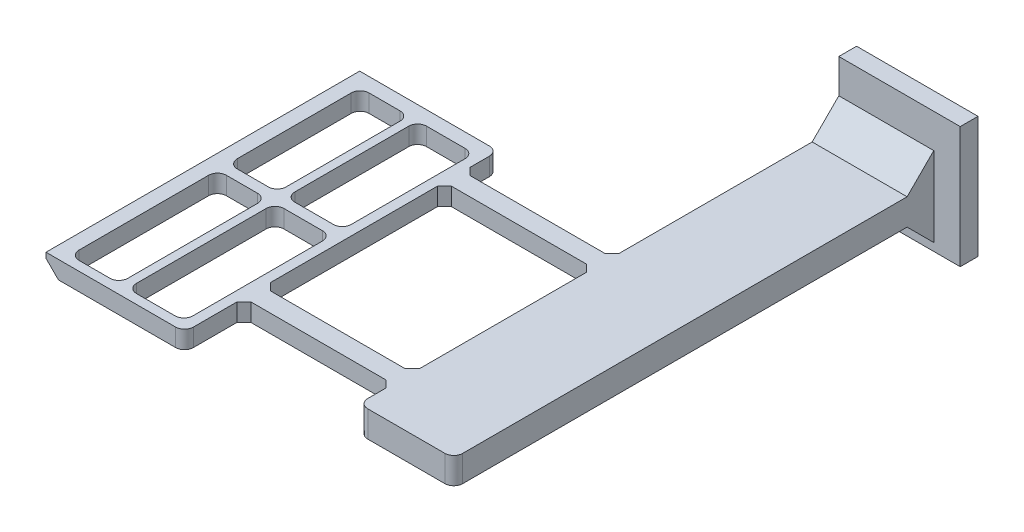
from build123d import *

# Parameters (mm, degrees)
SKETCH_1_W      = 68.292893219
SKETCH_1_H      = 68.292893218
EXTRUDE_1_DEPTH = 10
SKETCH_2_W      = 53.40749746
SKETCH_2_H      = 14.776374923
EXTRUDE_2_DEPTH = 270
SKETCH_4_W      = 27.47748939
SKETCH_4_H      = 82.93676663
SKETCH_4_H_2    = 74.09911356
SKETCH_4_W_2    = 31.70911111
EXTRUDE_3_DEPTH = 10
CHAMFER_1_SIZE  = 15
CHAMFER_3_SIZE  = 7
FILLET_3_R      = 5
CHAMFER_4_SIZE  = 4


with BuildPart() as part:
    # 草图1 → 凸台-拉伸1 (new body)
    with BuildSketch(Plane.XY):
        with Locations((-33.149855831, 2)):
            Rectangle(SKETCH_1_W, SKETCH_1_H)
    extrude(amount=EXTRUDE_1_DEPTH)

    # 草图2 → 凸台-拉伸2 (add)
    with BuildSketch(Plane.XY.offset(10)):
        with Locations((-40.59255371, -5.388187462)):
            Rectangle(SKETCH_2_W, SKETCH_2_H)
    extrude(amount=EXTRUDE_2_DEPTH)

    # 草图4 → 凸台-拉伸3 (add)
    with BuildSketch(Plane(origin=(0, 2, 0), x_dir=(1, 0, 0), z_dir=(0, 1, 0))):
        Polygon((-151.163737931, -260.803324395), (-67.29630244, -260.803324395), (-67.29630244, -249.935229756), (-151.163737931, -249.935229756), (-151.163737931, -147.989777894), (-67.29630244, -147.989777894), (-67.29630244, -137.604662475), (-151.163737931, -137.604662475), (-151.163737931, -117.751683705), (-229.082858204, -117.751683705), (-229.082858204, -294.217578605), (-151.163737931, -294.217578605), align=None)
        with Locations((-207.102608026, -247.45301447)):
            Rectangle(SKETCH_4_W, SKETCH_4_H, mode=Mode.SUBTRACT)
        with Locations((-207.102608026, -162.803209554)):
            Rectangle(SKETCH_4_W, SKETCH_4_H_2, mode=Mode.SUBTRACT)
        with Locations((-172.622136648, -247.45301447)):
            Rectangle(SKETCH_4_W_2, SKETCH_4_H, mode=Mode.SUBTRACT)
        with Locations((-172.622136648, -162.803209554)):
            Rectangle(SKETCH_4_W_2, SKETCH_4_H_2, mode=Mode.SUBTRACT)
    extrude(amount=-EXTRUDE_3_DEPTH)

    # 倒角1
    chamfer_1_edges = [part.edges().sort_by_distance(p)[0] for p in [
        (-40.59255371, 2, 10),
        (-40.59255371, -12.776374923, 10),
    ]]
    chamfer(chamfer_1_edges, length=CHAMFER_1_SIZE)

    # 倒角3
    chamfer_3_edges = [part.edges().sort_by_distance(p)[0] for p in [
        (-229.082858204, -8, 205.984631155),
    ]]
    chamfer(chamfer_3_edges, length=CHAMFER_3_SIZE)

    # 圆角3
    fillet_3_edges = [part.edges().sort_by_distance(p)[0] for p in [
        (-13.88880498, -5.388187462, 280),
        (-67.29630244, -5.388187462, 280),
        (-220.841352721, -3, 125.753652774),
        (-220.841352721, -3, 205.984631155),
        (-193.363863331, -3, 288.921397785),
        (-220.841352721, -3, 288.921397785),
        (-156.767581093, -3, 288.921397785),
        (-156.767581093, -3, 199.852766334),
        (-188.476692203, -3, 125.753652774),
        (-156.767581093, -3, 125.753652774),
        (-193.363863331, -3, 125.753652774),
        (-151.163737931, -3, 294.217578605),
        (-151.163737931, -3, 117.751683705),
        (-193.363863331, -3, 199.852766334),
        (-156.767581093, -3, 205.984631155),
        (-193.363863331, -3, 205.984631155),
        (-220.841352721, -3, 199.852766334),
        (-188.476692203, -3, 199.852766334),
        (-188.476692203, -3, 205.984631155),
        (-188.476692203, -3, 288.921397785),
    ]]
    fillet(fillet_3_edges, radius=FILLET_3_R)

    # 倒角4
    chamfer_4_edges = [part.edges().sort_by_distance(p)[0] for p in [
        (-67.29630244, -3, 249.935229756),
        (-67.29630244, -3, 260.803324395),
        (-151.163737931, -3, 260.803324395),
        (-151.163737931, -3, 137.604662475),
        (-67.29630244, -3, 137.604662475),
        (-67.29630244, -3, 147.989777894),
        (-151.163737931, -3, 147.989777894),
        (-151.163737931, -3, 249.935229756),
    ]]
    chamfer(chamfer_4_edges, length=CHAMFER_4_SIZE)


solid = part.part
